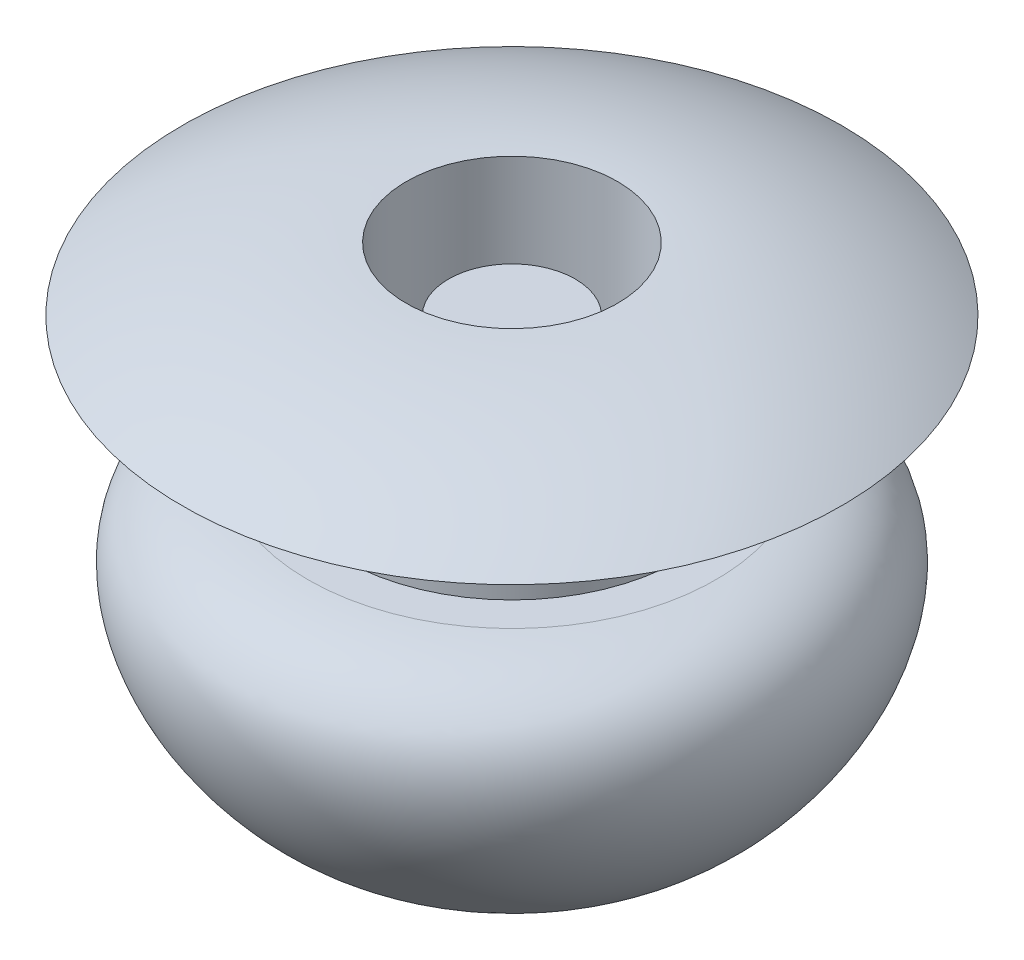
from build123d import *


with BuildPart() as part:
    # Szkic1 → Obrót1 (revolve)
    with BuildSketch(Plane(origin=(0, 0, 0), x_dir=(0, 0, -1), z_dir=(1, 0, 0)), mode=Mode.PRIVATE) as obr_t1_sk:
        with BuildLine():
            Line((0, 0), (-0.75, 0))
            Line((-0.75, 0), (-0.75, -1.700738523))
            Line((-0.75, -1.700738523), (-1.25, -1.700738523))
            Line((-1.25, -1.700738523), (-1.25, 0.75))
            ThreePointArc((-1.25, 0.75), (-2.627043935, 0.558888572), (-3.9, 0))
            Line((-3.9, 0), (-2, 0))
            Line((-2, 0), (-2, -1.5))
            Line((-2, -1.5), (-2.413891755, -1.5))
            add(Edge.make_bspline(
                [(-2.413891755, -1.5), (-3.867503112, -1.669657322), (-3.528877649, -3.802013626), (-1.083961642, -5.373532369), (-0.271752618, -3.374949298), (-0.956030427, -3.078929194)],
                knots=[0, 0, 0, 0, 0.464993082, 0.721927553, 1, 1, 1, 1], degree=3))
            add(Edge.make_bspline(
                [(-0.956030427, -3.078929194), (-0.520263876, -3.200738523), (0, -3.200738523)],
                knots=[0.992852221, 0.992852221, 0.992852221, 1.570796327, 1.570796327, 1.570796327], degree=2, weights=[1, 0.958537313, 1]))
            Line((0, -3.200738523), (0, -1.700738523))
            Line((0, -1.700738523), (0, 0))
        make_face()
    revolve(obr_t1_sk.sketch.rotate(Axis((0, 0, 0), (0, 1, 0)), 180), axis=Axis((0, 0, 0), (0, 1, 0)))


solid = part.part
